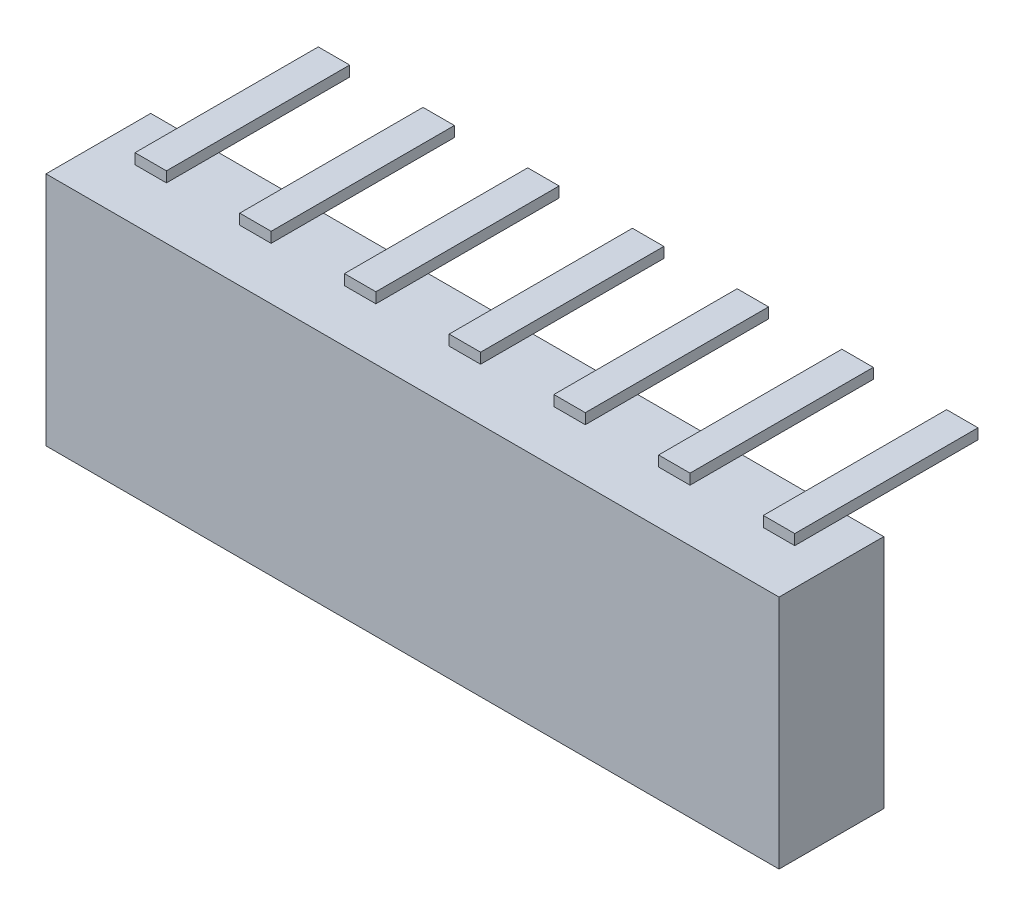
from build123d import *

# Parameters (mm, degrees)
SKETCH1_W                  = 2
SKETCH1_H                  = 4.5
BOSS_EXTRUDE1_DEPTH        = 2
SKETCH2_W                  = 0.8
SKETCH2_H                  = 0.8
CUT_EXTRUDE1_DEPTH         = 2.8
CHAMFER1_SIZE              = 0.2
SKETCH3_W                  = 3.5
SKETCH3_H                  = 0.2
BOSS_EXTRUDE2_DEPTH        = 0.3
LPATTERN1_COUNT            = 7
LPATTERN1_PITCH            = 2
CHAMFER1_OF_LPATTERN1_SIZE = 0.2


with BuildPart() as part:
    # Sketch1 → Boss-Extrude1 (new body)
    with BuildSketch(Plane.XY):
        Rectangle(SKETCH1_W, SKETCH1_H)
    boss_extrude1 = extrude(amount=BOSS_EXTRUDE1_DEPTH)

    # Sketch2 → Cut-Extrude1 (cut)
    with BuildSketch(Plane.XZ.offset(2.25)):
        with Locations((0, 1)):
            Rectangle(SKETCH2_W, SKETCH2_H)
    cut_extrude1 = extrude(amount=-CUT_EXTRUDE1_DEPTH, mode=Mode.SUBTRACT)

    # Chamfer1
    chamfer1_edges = [part.edges().sort_by_distance(p)[0] for p in [
        (0.4, -2.25, 1),
        (0, -2.25, 1.4),
        (-0.4, -2.25, 1),
        (0, -2.25, 0.6),
    ]]
    chamfer(chamfer1_edges, length=CHAMFER1_SIZE)

    # Sketch3 → Boss-Extrude2 (add, symmetric)
    with BuildSketch(Plane(origin=(0, 0, 0), x_dir=(0, 0, -1), z_dir=(1, 0, 0))):
        with Locations((0.75, 2.35)):
            Rectangle(SKETCH3_W, SKETCH3_H)
    boss_extrude2 = extrude(amount=BOSS_EXTRUDE2_DEPTH, both=True)

    # LPattern1: Boss-Extrude1, Cut-Extrude1, Boss-Extrude2 ×7
    with Locations(*[(i * LPATTERN1_PITCH, 0, 0) for i in range(1, LPATTERN1_COUNT)]):
        add(boss_extrude1)
        add(cut_extrude1, mode=Mode.SUBTRACT)
        add(boss_extrude2)

    # Chamfer1 of LPattern1
    chamfer1_of_lpattern1_edges = [part.edges().sort_by_distance(p)[0] for p in [
        (2.4, -2.25, 1),
        (2, -2.25, 1.4),
        (1.6, -2.25, 1),
        (2, -2.25, 0.6),
        (4.4, -2.25, 1),
        (4, -2.25, 1.4),
        (3.6, -2.25, 1),
        (4, -2.25, 0.6),
        (6.4, -2.25, 1),
        (6, -2.25, 1.4),
        (5.6, -2.25, 1),
        (6, -2.25, 0.6),
        (8.4, -2.25, 1),
        (8, -2.25, 1.4),
        (7.6, -2.25, 1),
        (8, -2.25, 0.6),
        (10.4, -2.25, 1),
        (10, -2.25, 1.4),
        (9.6, -2.25, 1),
        (10, -2.25, 0.6),
        (12.4, -2.25, 1),
        (12, -2.25, 1.4),
        (11.6, -2.25, 1),
        (12, -2.25, 0.6),
    ]]
    chamfer(chamfer1_of_lpattern1_edges, length=CHAMFER1_OF_LPATTERN1_SIZE)


solid = part.part
